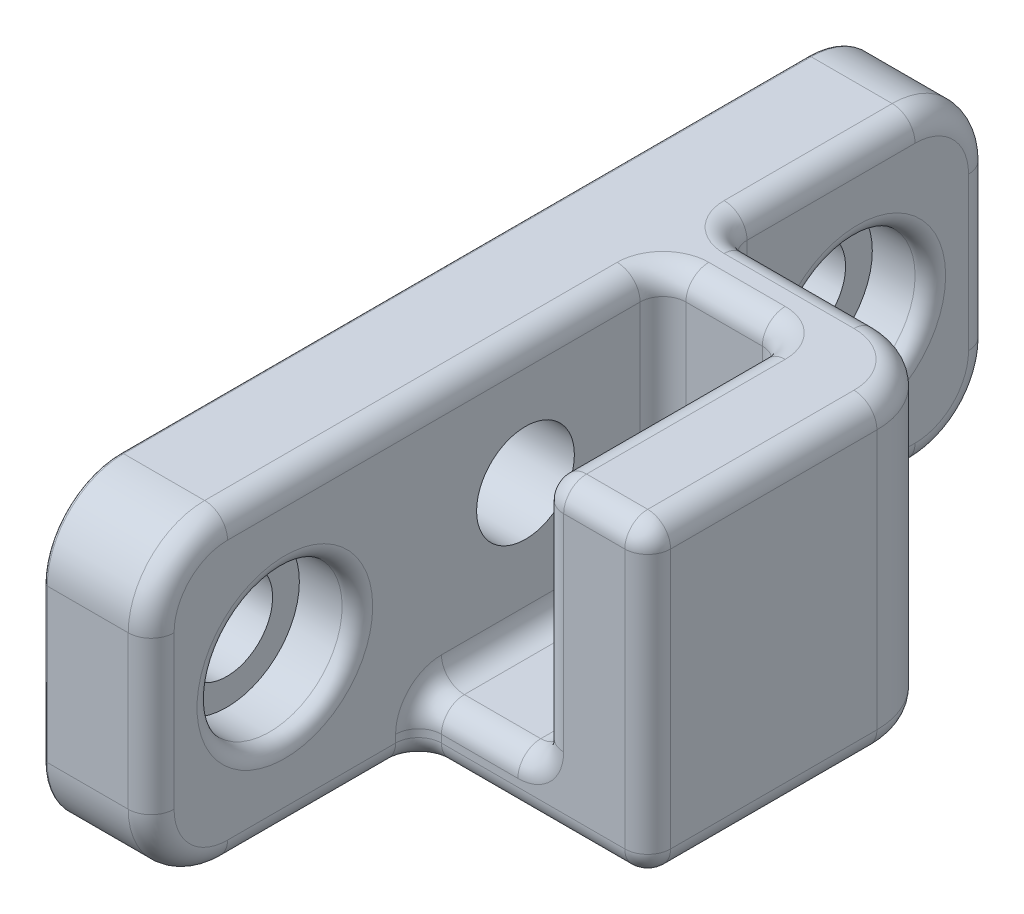
from build123d import *

# Parameters (mm, degrees)
BOSS_EXTRUDE1_DEPTH = 10
BOSS_EXTRUDE2_START = -10
SKETCH1_3_W         = 8
SKETCH1_3_H         = 16
BOSS_EXTRUDE2_DEPTH = 3.5
SKETCH2_R           = 3.2
CUT_EXTRUDE1_DEPTH  = 20
SKETCH2_4_R         = 3
CUT_EXTRUDE2_DEPTH  = 7
CUT_EXTRUDE5_START  = -3.2
SKETCH2_6_R         = 4.75
SKETCH2_6_R_2       = 3
CUT_EXTRUDE5_DEPTH  = 3.8
SKETCH4_W           = 3
SKETCH4_H           = 3
CUT_EXTRUDE9_DEPTH  = 0.3
CUT_EXTRUDE10_START = -0.6
SKETCH4_3_W         = 3
SKETCH4_3_H         = 3
CUT_EXTRUDE10_DEPTH = 0.3
FILLET1_R           = 5
FILLET2_R           = 1.5
FILLET3_R           = 1
FILLET4_R           = 0.2


with BuildPart() as part:
    # Sketch1 → Boss-Extrude1 (new, symmetric)
    with BuildSketch(Plane(origin=(0, 0, 0), x_dir=(1, 0, 0), z_dir=(0, 1, 0))):
        Polygon((-4, -24.5), (-11, -24.5), (-11, 30.5), (-4, 30.5), (-4, 13), (11, 13), (11, -7), (4, -7), (4, 9), (-4, 9), align=None)
    extrude(amount=BOSS_EXTRUDE1_DEPTH, both=True)

    # Sketch1<3> → Boss-Extrude2 (add)
    with BuildSketch(Plane(origin=(0, 0, 0), x_dir=(1, 0, 0), z_dir=(0, 1, 0)).offset(BOSS_EXTRUDE2_START)):
        with Locations((0, 1)):
            Rectangle(SKETCH1_3_W, SKETCH1_3_H)
    extrude(amount=BOSS_EXTRUDE2_DEPTH)

    # Sketch2 → Cut-Extrude1 (cut)
    with BuildSketch(Plane.ZY.offset(11)):
        with Locations((0, 2)):
            Circle(SKETCH2_R)
    extrude(amount=-CUT_EXTRUDE1_DEPTH, mode=Mode.SUBTRACT)

    # Sketch2<4> → Cut-Extrude2 (cut)
    with BuildSketch(Plane.ZY.offset(11)):
        with Locations((-21.75, 0)):
            Circle(SKETCH2_4_R)
        with Locations((15.75, 0)):
            Circle(SKETCH2_4_R)
    extrude(amount=-CUT_EXTRUDE2_DEPTH, mode=Mode.SUBTRACT)

    # Sketch2<6> → Cut-Extrude5 (cut)
    # profile 1 of 2: a face of its own
    with BuildSketch(Plane.ZY.offset(11).offset(CUT_EXTRUDE5_START)):
        with Locations(Location((-21.75, 0, 0), (0, 0, 180))):
            Circle(SKETCH2_6_R)
        with Locations((-21.75, 0)):
            Circle(SKETCH2_6_R_2, mode=Mode.SUBTRACT)
    # profile 2 of 2: a face of its own
    with BuildSketch(Plane.ZY.offset(11).offset(CUT_EXTRUDE5_START)):
        with Locations(Location((15.75, 0, 0), (0, 0, 180))):
            Circle(SKETCH2_6_R)
        with Locations((15.75, 0)):
            Circle(SKETCH2_6_R_2, mode=Mode.SUBTRACT)
    extrude(amount=-CUT_EXTRUDE5_DEPTH, mode=Mode.SUBTRACT)

    # Sketch4 → Cut-Extrude9 (cut)
    with BuildSketch(Plane.ZY.offset(-9)):
        with BuildLine():
            Line((-1.5, 0.5), (-1.5, 3.5))
            Line((-1.5, 3.5), (-2.826658805, 3.5))
            ThreePointArc((-2.826658805, 3.5), (-3.105262322, 2.772881564), (-3.2, 2))
            ThreePointArc((-3.2, 2), (-3.105262322, 1.227118436), (-2.826658805, 0.5))
            Line((-2.826658805, 0.5), (-1.5, 0.5))
        make_face()
        with Locations((0, 2)):
            Rectangle(SKETCH4_W, SKETCH4_H)
        with BuildLine():
            Line((2.826658805, 3.5), (1.5, 3.5))
            Line((1.5, 3.5), (1.5, 0.5))
            Line((1.5, 0.5), (2.826658805, 0.5))
            ThreePointArc((2.826658805, 0.5), (3.105262322, 1.227118436), (3.2, 2))
            ThreePointArc((3.2, 2), (3.105262322, 2.772881564), (2.826658805, 3.5))
        make_face()
    extrude(amount=-CUT_EXTRUDE9_DEPTH, mode=Mode.SUBTRACT)

    # Sketch4<3> → Cut-Extrude10 (cut)
    with BuildSketch(Plane.ZY.offset(-9).offset(CUT_EXTRUDE10_START)):
        with Locations((0, 2)):
            Rectangle(SKETCH4_3_W, SKETCH4_3_H)
    extrude(amount=CUT_EXTRUDE10_DEPTH, mode=Mode.SUBTRACT)

    # Fillet1
    fillet1_edges = [part.edges().sort_by_distance(p)[0] for p in [
        (-7.5, -10, -30.5),
        (-7.5, -10, 24.5),
        (11, 0, -13),
        (-7.5, 10, -30.5),
        (-7.5, 10, 24.5),
    ]]
    fillet(fillet1_edges, radius=FILLET1_R)

    # Fillet2
    fillet2_edges = [part.edges().sort_by_distance(p)[0] for p in [
        (-4, 10, 5.25),
        (-4, -10, -19.25),
        (11, -10, -0.5),
        (9.535533906, -10, -11.535533906),
        (11, 10, -0.5),
        (-4, 10, -19.25),
        (9.535533906, 10, -11.535533906),
        (-4, 0, -30.5),
        (-4, 8.535533906, -29.035533906),
        (-4, -8.535533906, -29.035533906),
        (-4, 0, 24.5),
        (-4, -8.535533906, 23.035533906),
        (-4, 8.535533906, 23.035533906),
        (1, -10, -13),
        (3.5, -10, 7),
        (0, 10, -9),
        (-4, 0, -13),
        (11, 0, 7),
        (4, 1.75, 7),
        (4, 1.75, -9),
        (-4, 1.75, -9),
        (4, 10, -1),
        (7.5, 10, 7),
        (-4, -10, 13.25),
        (1, 10, -13),
        (0, -6.5, 7),
        (-4, -8.25, 7),
        (-4, -6.5, -1),
        (4, -6.5, -1),
        (0, -6.5, -9),
    ]]
    fillet(fillet2_edges, radius=FILLET2_R)

    # Fillet3
    fillet3_edges = [part.edges().sort_by_distance(p)[0] for p in [
        (-4, 0, -17),
        (-4, 0, 20.5),
    ]]
    fillet(fillet3_edges, radius=FILLET3_R)

    # Fillet4
    fillet4_edges = [part.edges().sort_by_distance(p)[0] for p in [
        (-11, -10, -3),
        (-11, 10, -3),
        (-11, 0, -30.5),
        (-11, 0, 24.5),
        (-11, -8.535533906, 23.035533906),
        (-11, 8.535533906, 23.035533906),
        (-11, 8.535533906, -29.035533906),
        (-11, -8.535533906, -29.035533906),
        (-11, 2, -3.2),
        (-11, 0, -24.75),
        (-11, 0, 12.75),
    ]]
    fillet(fillet4_edges, radius=FILLET4_R)


solid = part.part
